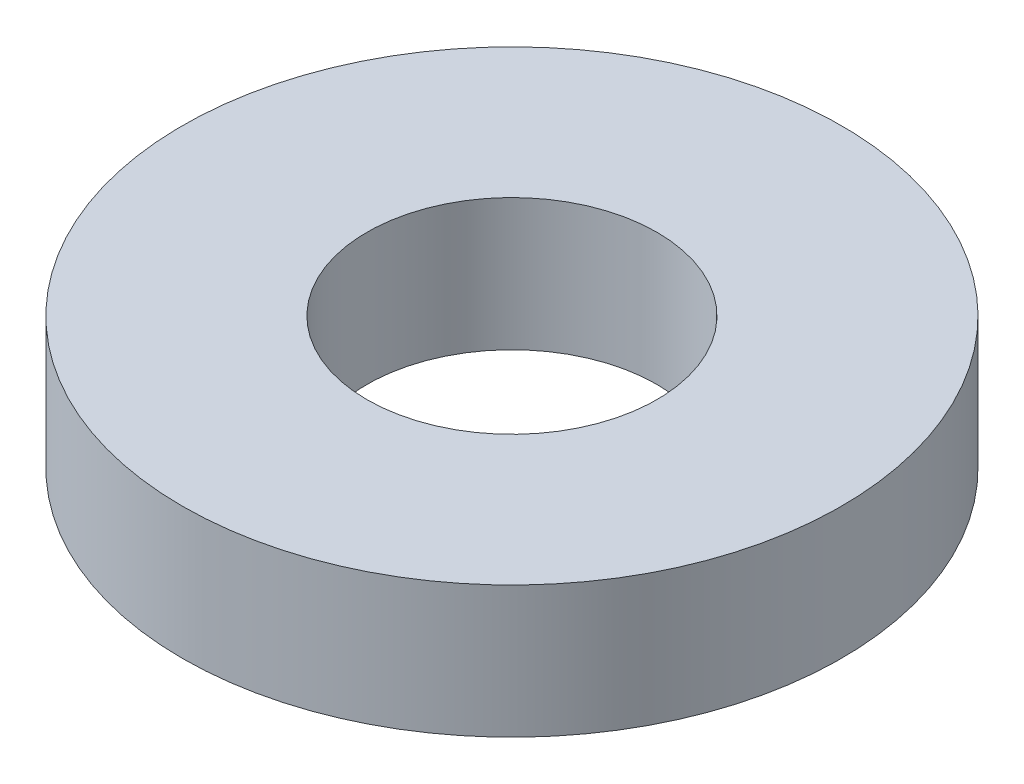
from build123d import *

# Parameters (mm, degrees)
SKETCH1_R           = 2.5
SKETCH1_R_2         = 1.1
BOSS_EXTRUDE1_DEPTH = 1


with BuildPart() as part:
    # Sketch1 → Boss-Extrude1 (new body)
    with BuildSketch(Plane(origin=(0, 0, 0), x_dir=(1, 0, 0), z_dir=(0, 1, 0))):
        with Locations(Location((0, 0, 0), (0, 0, 270))):
            Circle(SKETCH1_R)
        with Locations(Location((0, 0, 0), (0, 0, 270))):
            Circle(SKETCH1_R_2, mode=Mode.SUBTRACT)
    extrude(amount=BOSS_EXTRUDE1_DEPTH)


solid = part.part
